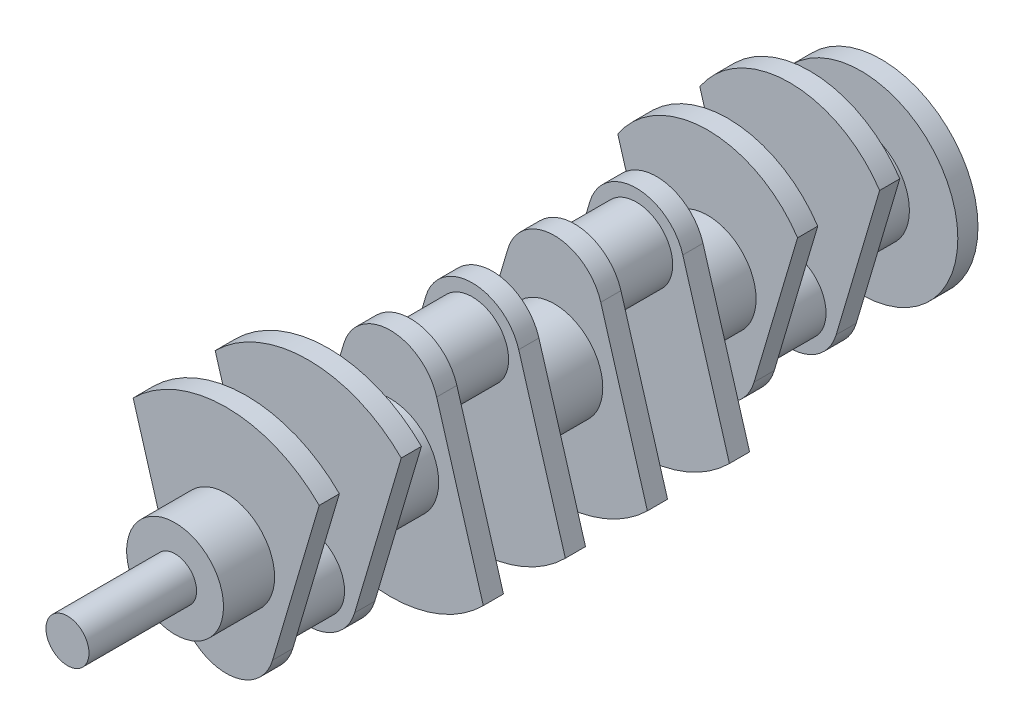
from build123d import *

# Parameters (mm, degrees)
ESBO_O1_R                 = 72
RESSALTO_EXTRUS_O1_DEPTH  = 15
ESBO_O1_3_R               = 36
RESSALTO_EXTRUS_O2_DEPTH  = 53
RESSALTO_EXTRUS_O3_DEPTH  = 15
ESBO_O3_R                 = 27
RESSALTO_EXTRUS_O4_DEPTH  = 46
RESSALTO_EXTRUS_O5_DEPTH  = 15
ESBO_O5_R                 = 36
RESSALTO_EXTRUS_O6_DEPTH  = 38
RESSALTO_EXTRUS_O7_DEPTH  = 15
ESBO_O7_R                 = 27
RESSALTO_EXTRUS_O8_DEPTH  = 46
RESSALTO_EXTRUS_O9_DEPTH  = 15
ESBO_O11_R                = 36
RESSALTO_EXTRUS_O10_DEPTH = 46
RESSALTO_EXTRUS_O11_DEPTH = 15
ESBO_O13_R                = 27
RESSALTO_EXTRUS_O12_DEPTH = 46
RESSALTO_EXTRUS_O13_DEPTH = 15
ESBO_O16_R                = 36
RESSALTO_EXTRUS_O14_DEPTH = 46
RESSALTO_EXTRUS_O15_DEPTH = 15
ESBO_O19_R                = 27
RESSALTO_EXTRUS_O16_DEPTH = 46
RESSALTO_EXTRUS_O17_DEPTH = 15
ESBO_O21_R                = 36
RESSALTO_EXTRUS_O18_DEPTH = 38
ESBO_O22_R                = 16
RESSALTO_EXTRUS_O19_DEPTH = 80


with BuildPart() as part:
    # Esboço1 → Ressalto-extrusão1 (new body)
    with BuildSketch(Plane.XY):
        Circle(ESBO_O1_R)
    extrude(amount=RESSALTO_EXTRUS_O1_DEPTH)

    # Esboço1<3> → Ressalto-extrusão2 (add)
    with BuildSketch(Plane.XY):
        Circle(ESBO_O1_3_R)
    extrude(amount=RESSALTO_EXTRUS_O2_DEPTH)

    # Esboço2 → Ressalto-extrusão3 (add)
    with BuildSketch(Plane.XY.offset(53)):
        with BuildLine():
            Line((-66.843990193, 54.907814237), (-34.517510455, -54.224552409))
            ThreePointArc((-34.517510455, -54.224552409), (0, -80), (34.517510455, -54.224552409))
            Line((34.517510455, -54.224552409), (66.843990193, 54.907814237))
            ThreePointArc((66.843990193, 54.907814237), (0, 90.954646262), (-66.843990193, 54.907814237))
        make_face()
    extrude(amount=RESSALTO_EXTRUS_O3_DEPTH)

    # Esboço3 → Ressalto-extrusão4 (add)
    with BuildSketch(Plane.XY.offset(68)):
        with Locations((0, -44)):
            Circle(ESBO_O3_R)
    extrude(amount=RESSALTO_EXTRUS_O4_DEPTH)

    # Esboço4 → Ressalto-extrusão5 (add)
    with BuildSketch(Plane.XY.offset(114)):
        with BuildLine():
            Line((-66.84328916, 54.905447591), (-34.517510455, -54.224552409))
            ThreePointArc((-34.517510455, -54.224552409), (0, -80), (34.517510455, -54.224552409))
            Line((34.517510455, -54.224552409), (66.84328916, 54.905447591))
            ThreePointArc((66.84328916, 54.905447591), (0, 90.951213503), (-66.84328916, 54.905447591))
        make_face()
    extrude(amount=RESSALTO_EXTRUS_O5_DEPTH)

    # Esboço5 → Ressalto-extrusão6 (add)
    with BuildSketch(Plane.XY.offset(129)):
        Circle(ESBO_O5_R)
    extrude(amount=RESSALTO_EXTRUS_O6_DEPTH)

    # Esboço6 → Ressalto-extrusão7 (add)
    with BuildSketch(Plane.XY.offset(167)):
        with BuildLine():
            ThreePointArc((34.517510455, 54.224552409), (0, 80), (-34.517510455, 54.224552409))
            Line((-34.517510455, 54.224552409), (-69.175757545, -62.779728891))
            ThreePointArc((-69.175757545, -62.779728891), (0, -91.433265854), (69.175757545, -62.779728891))
            Line((69.175757545, -62.779728891), (34.517510455, 54.224552409))
        make_face()
    extrude(amount=RESSALTO_EXTRUS_O7_DEPTH)

    # Esboço7 → Ressalto-extrusão8 (add)
    with BuildSketch(Plane.XY.offset(182)):
        with Locations((0, 44)):
            Circle(ESBO_O7_R)
    extrude(amount=RESSALTO_EXTRUS_O8_DEPTH)

    # Esboço8 → Ressalto-extrusão9 (add)
    with BuildSketch(Plane.XY.offset(228)):
        with BuildLine():
            ThreePointArc((34.517510455, 54.224552409), (0, 80), (-34.517510455, 54.224552409))
            Line((-34.517510455, 54.224552409), (-69.174489366, -62.775447591))
            ThreePointArc((-69.174489366, -62.775447591), (0, -90.992481793), (69.174489366, -62.775447591))
            Line((69.174489366, -62.775447591), (34.517510455, 54.224552409))
        make_face()
    extrude(amount=RESSALTO_EXTRUS_O9_DEPTH)

    # Esboço11 → Ressalto-extrusão10 (add)
    with BuildSketch(Plane.XY.offset(243)):
        Circle(ESBO_O11_R)
    extrude(amount=RESSALTO_EXTRUS_O10_DEPTH)

    # Esboço12 → Ressalto-extrusão11 (add)
    with BuildSketch(Plane.XY.offset(289)):
        with BuildLine():
            ThreePointArc((34.517510455, 54.224552409), (0, 80), (-34.517510455, 54.224552409))
            Line((-34.517510455, 54.224552409), (-69.174489366, -62.775447591))
            ThreePointArc((-69.174489366, -62.775447591), (0, -91.428459256), (69.174489366, -62.775447591))
            Line((69.174489366, -62.775447591), (34.517510455, 54.224552409))
        make_face()
    extrude(amount=RESSALTO_EXTRUS_O11_DEPTH)

    # Esboço13 → Ressalto-extrusão12 (add)
    with BuildSketch(Plane.XY.offset(304)):
        with Locations((0, 44)):
            Circle(ESBO_O13_R)
    extrude(amount=RESSALTO_EXTRUS_O12_DEPTH)

    # Esboço15 → Ressalto-extrusão13 (add)
    with BuildSketch(Plane.XY.offset(350)):
        with BuildLine():
            ThreePointArc((34.517510455, 54.224552409), (0, 80), (-34.517510455, 54.224552409))
            Line((-34.517510455, 54.224552409), (-69.174489366, -62.775447591))
            ThreePointArc((-69.174489366, -62.775447591), (0, -91.544832234), (69.174489366, -62.775447591))
            Line((69.174489366, -62.775447591), (34.517510455, 54.224552409))
        make_face()
    extrude(amount=RESSALTO_EXTRUS_O13_DEPTH)

    # Esboço16 → Ressalto-extrusão14 (add)
    with BuildSketch(Plane.XY.offset(365)):
        Circle(ESBO_O16_R)
    extrude(amount=RESSALTO_EXTRUS_O14_DEPTH)

    # Esboço18 → Ressalto-extrusão15 (add)
    with BuildSketch(Plane.XY.offset(411)):
        with BuildLine():
            ThreePointArc((69.174489366, 62.775447591), (0, 91.428459256), (-69.174489366, 62.775447591))
            Line((-69.174489366, 62.775447591), (-34.517510455, -54.224552409))
            ThreePointArc((-34.517510455, -54.224552409), (0, -80), (34.517510455, -54.224552409))
            Line((34.517510455, -54.224552409), (69.174489366, 62.775447591))
        make_face()
    extrude(amount=RESSALTO_EXTRUS_O15_DEPTH)

    # Esboço19 → Ressalto-extrusão16 (add)
    with BuildSketch(Plane.XY.offset(426)):
        with Locations((0, -44)):
            Circle(ESBO_O19_R)
    extrude(amount=RESSALTO_EXTRUS_O16_DEPTH)

    # Esboço20 → Ressalto-extrusão17 (add)
    with BuildSketch(Plane.XY.offset(472)):
        with BuildLine():
            ThreePointArc((69.174489366, 62.775447591), (0, 91.428459256), (-69.174489366, 62.775447591))
            Line((-69.174489366, 62.775447591), (-34.517510455, -54.224552409))
            ThreePointArc((-34.517510455, -54.224552409), (0, -80), (34.517510455, -54.224552409))
            Line((34.517510455, -54.224552409), (69.174489366, 62.775447591))
        make_face()
    extrude(amount=RESSALTO_EXTRUS_O17_DEPTH)

    # Esboço21 → Ressalto-extrusão18 (add)
    with BuildSketch(Plane.XY.offset(487)):
        Circle(ESBO_O21_R)
    extrude(amount=RESSALTO_EXTRUS_O18_DEPTH)

    # Esboço22 → Ressalto-extrusão19 (add)
    with BuildSketch(Plane.XY.offset(525)):
        Circle(ESBO_O22_R)
    extrude(amount=RESSALTO_EXTRUS_O19_DEPTH)


solid = part.part
